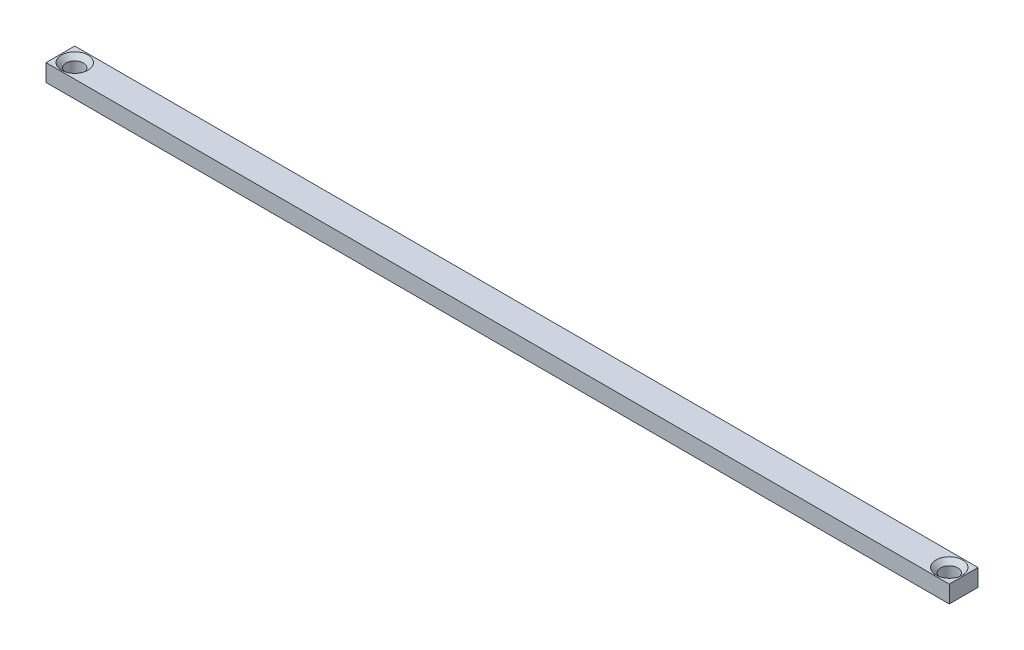
from build123d import *

# Parameters (mm, degrees)
SKETCH1_W           = 157.22
SKETCH1_H           = 5
SKETCH1_R           = 1.5
BOSS_EXTRUDE1_DEPTH = 3
CHAMFER1_SIZE       = 0.8


with BuildPart() as part:
    # Sketch1 → Boss-Extrude1 (new body)
    with BuildSketch(Plane(origin=(0, 0, 0), x_dir=(1, 0, 0), z_dir=(0, 1, 0))):
        with Locations((-62.948583844, 2.817602284)):
            Rectangle(SKETCH1_W, SKETCH1_H)
        with Locations(Location((13.161416156, 2.817602284, 0), (0, 0, 270))):
            Circle(SKETCH1_R, mode=Mode.SUBTRACT)
        with Locations(Location((-139.058583844, 2.817602284, 0), (0, 0, 270))):
            Circle(SKETCH1_R, mode=Mode.SUBTRACT)
    extrude(amount=BOSS_EXTRUDE1_DEPTH)

    # Chamfer1
    chamfer1_edges = [part.edges().sort_by_distance(p)[0] for p in [
        (13.161416156, 3, -4.317602284),
        (-139.058583844, 3, -4.317602284),
    ]]
    chamfer(chamfer1_edges, length=CHAMFER1_SIZE)


solid = part.part
